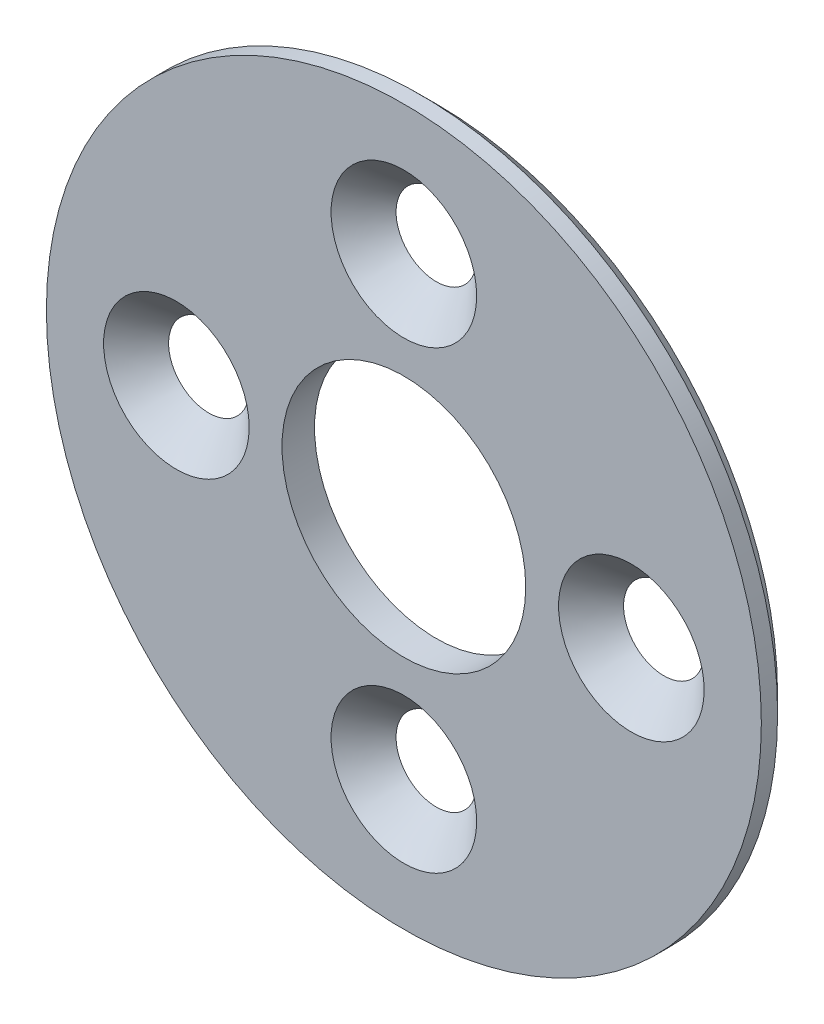
from build123d import *

# Parameters (mm, degrees)
SKETCH_1_R                  = 22
SKETCH_1_R_2                = 7.5
EXTRUDE_1_DEPTH             = 2
CHAMFER_1_SIZE              = 1
HOLE_WIZARD_M4_1_AT_2_COUNT = 2
HOLE_WIZARD_M4_1_AT_2_PITCH = 28
HOLE_WIZARD_M4_1_AT_3_COUNT = 2
HOLE_WIZARD_M4_1_AT_3_PITCH = 19.798989873
HOLE_WIZARD_M4_1_AT_4_COUNT = 2
HOLE_WIZARD_M4_1_AT_4_PITCH = 19.798989873


with BuildPart() as part:
    # 草图1 → 凸台-拉伸1 (new body)
    with BuildSketch(Plane.XY):
        Circle(SKETCH_1_R)
        Circle(SKETCH_1_R_2, mode=Mode.SUBTRACT)
    extrude(amount=EXTRUDE_1_DEPTH)

    # 倒角1
    chamfer_1_edges = [part.edges().sort_by_distance(p)[0] for p in [
        (-22, 0, 0),
    ]]
    chamfer(chamfer_1_edges, length=CHAMFER_1_SIZE)

    # 草图2 → M4 六角凹锥坑螺钉的锥形沉头孔1 (revolve, cut)
    with BuildSketch(Plane(origin=(0, 14, 2), x_dir=(0, -1, 0), z_dir=(1, 0, 0))):
        Polygon((0, 0), (0, 2), (2.25, 2), (2.25, 2.23), (4.48, 0), align=None)
    hole_wizard_m4_1 = revolve(axis=Axis((0, 14, 8.35), (0, 0, -1)), mode=Mode.SUBTRACT)

    # M4 六角凹锥坑螺钉的锥形沉头孔1 at 2: M4 六角凹锥坑螺钉的锥形沉头孔1 ×2
    with Locations(*[(0, -i * HOLE_WIZARD_M4_1_AT_2_PITCH, 0) for i in range(1, HOLE_WIZARD_M4_1_AT_2_COUNT)]):
        add(hole_wizard_m4_1, mode=Mode.SUBTRACT)

    # M4 六角凹锥坑螺钉的锥形沉头孔1 at 3: M4 六角凹锥坑螺钉的锥形沉头孔1 ×2
    with Locations(*[Vector(-0.7071067811865476, -0.7071067811865476, 0) * (i * HOLE_WIZARD_M4_1_AT_3_PITCH) for i in range(1, HOLE_WIZARD_M4_1_AT_3_COUNT)]):
        add(hole_wizard_m4_1, mode=Mode.SUBTRACT)

    # M4 六角凹锥坑螺钉的锥形沉头孔1 at 4: M4 六角凹锥坑螺钉的锥形沉头孔1 ×2
    with Locations(*[Vector(0.7071067811865475, -0.7071067811865476, 0) * (i * HOLE_WIZARD_M4_1_AT_4_PITCH) for i in range(1, HOLE_WIZARD_M4_1_AT_4_COUNT)]):
        add(hole_wizard_m4_1, mode=Mode.SUBTRACT)


solid = part.part
